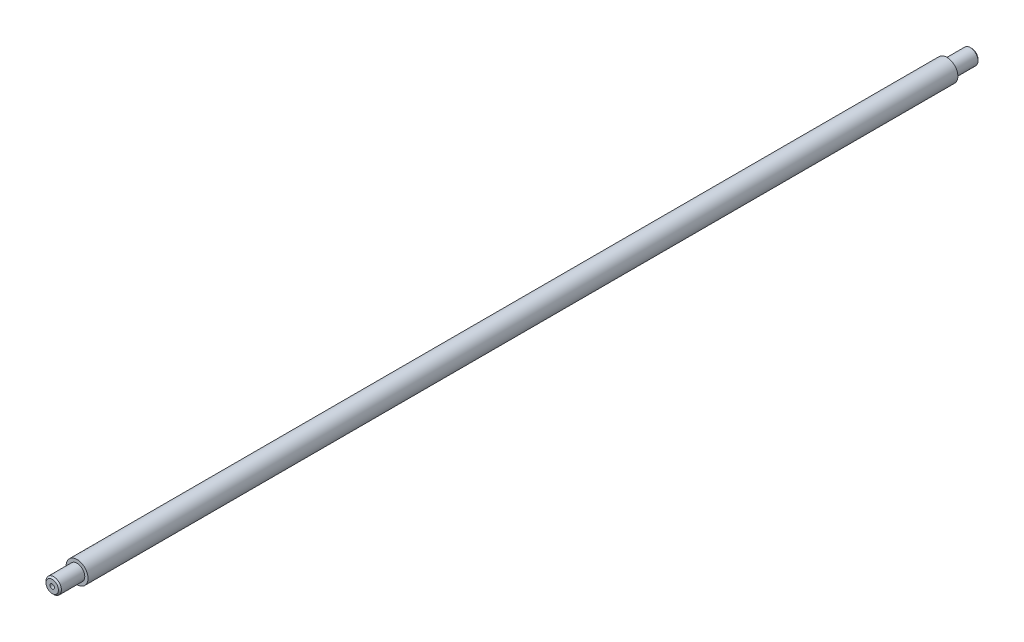
from build123d import *

# Parameters (mm, degrees)
SKETCH2_R           = 5.588
BOSS_EXTRUDE1_DEPTH = 222.25
SKETCH3_R           = 3.937
BOSS_EXTRUDE2_DEPTH = 12.7
BOSS_EXTRUDE3_START = 12.7
SKETCH4_R           = 3.937
BOSS_EXTRUDE3_DEPTH = 12.7
SKETCH5_R           = 1.143
CUT_EXTRUDE1_DEPTH  = 25.4
CUT_EXTRUDE2_START  = -25.4
SKETCH6_R           = 1.143
CUT_EXTRUDE2_DEPTH  = 25.4
CHAMFER2_SIZE       = 0.762


with BuildPart() as part:
    # Sketch2 → Boss-Extrude1 (new, symmetric)
    with BuildSketch(Plane.XY):
        Circle(SKETCH2_R)
    extrude(amount=BOSS_EXTRUDE1_DEPTH, both=True)

    # Sketch3 → Boss-Extrude2 (add)
    with BuildSketch(Plane.XY.offset(222.25)):
        Circle(SKETCH3_R)
    extrude(amount=BOSS_EXTRUDE2_DEPTH)

    # Sketch4 → Boss-Extrude3 (add)
    with BuildSketch(Plane(origin=(0, 0, -222.25), x_dir=(-1, 0, 0), z_dir=(0, 0, -1)).offset(BOSS_EXTRUDE3_START)):
        with Locations(Location((0, 0, 0), (0, 0, 180))):
            Circle(SKETCH4_R)
    extrude(amount=-BOSS_EXTRUDE3_DEPTH)

    # Sketch5 → Cut-Extrude1 (cut)
    with BuildSketch(Plane.XY.offset(234.95)):
        Circle(SKETCH5_R)
    extrude(amount=-CUT_EXTRUDE1_DEPTH, mode=Mode.SUBTRACT)

    # Sketch6 → Cut-Extrude2 (cut)
    with BuildSketch(Plane(origin=(0, 0, -234.95), x_dir=(-1, 0, 0), z_dir=(0, 0, -1)).offset(CUT_EXTRUDE2_START)):
        with Locations(Location((0, 0, 0), (0, 0, 180))):
            Circle(SKETCH6_R)
    extrude(amount=CUT_EXTRUDE2_DEPTH, mode=Mode.SUBTRACT)

    # Chamfer2
    chamfer2_edges = [part.edges().sort_by_distance(p)[0] for p in [
        (-3.937, 0, -234.95),
        (-3.937, 0, 234.95),
    ]]
    chamfer(chamfer2_edges, length=CHAMFER2_SIZE)


solid = part.part
